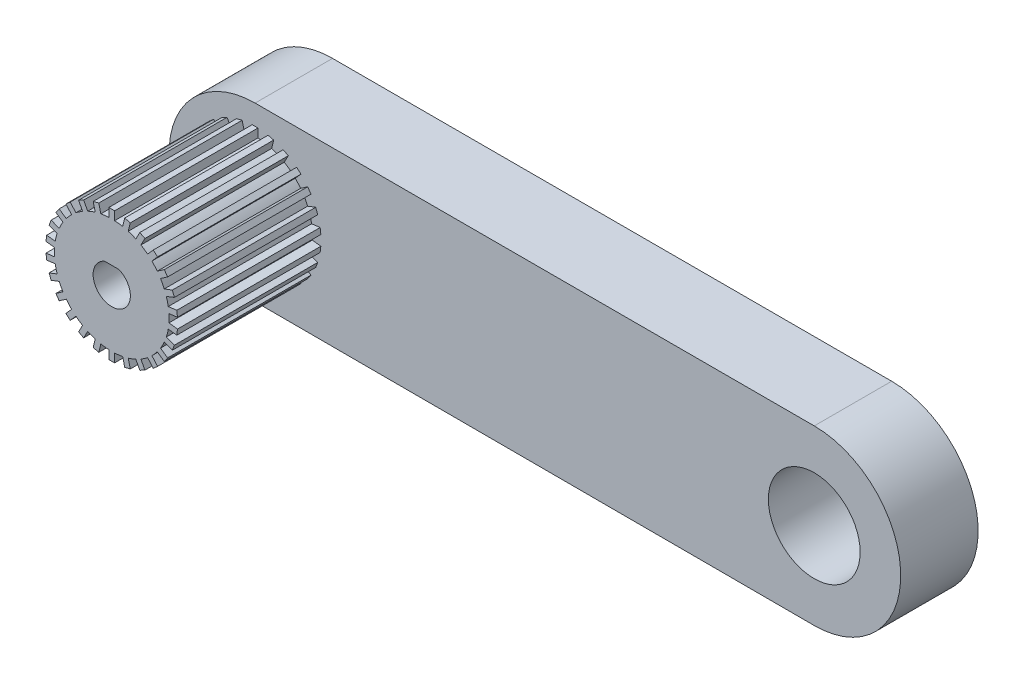
from build123d import *
from build123d.topology import SkipClean

# Parameters (mm, degrees)
BOSS_EXTRUDE1_DEPTH     = 15
SKETCH2_R               = 10
SKETCH2_R_2             = 2.575
BOSS_EXTRUDE2_DEPTH     = 20
SKETCH4_W               = 241.678854034
SKETCH4_H               = 67.941669626
CUT_EXTRUDE2_DEPTH      = 1.5
SKETCH5_R               = 10
SKETCH5_R_2             = 2.575
BOSS_EXTRUDE3_DEPTH     = 10
SKETCH6_R               = 8
CUT_EXTRUDE3_DEPTH      = 122.635473657
BOSS_EXTRUDE4_DEPTH     = 13.5
CUT_EXTRUDE4_DEPTH      = 122.635473657
CUT_EXTRUDE4_DEPTH_BACK = 122.635473657
CUT_EXTRUDE5_START      = -5
SKETCH11_R              = 10
CUT_EXTRUDE5_DEPTH      = 5
BOSS_EXTRUDE5_START     = -25
BOSS_EXTRUDE5_DEPTH     = 25


with BuildPart() as part:
    # Sketch1 → Boss-Extrude1 (new body)
    with BuildSketch(Plane.XY):
        with BuildLine():
            Line((0, -15), (97.476715067, -15.151699694))
            ThreePointArc((97.476715067, -15.151699694), (112.576031495, -0.087589988), (97.500177084, 15))
            Line((97.500177084, 15), (0, 15))
            ThreePointArc((0, 15), (-15, 0), (0, -15))
        make_face()
        with BuildLine():
            ThreePointArc((32.500177084, 7.424141025), (25.000177084, -0.075858975), (32.500177084, -7.575858975))
            Line((32.500177084, -7.575858975), (97.500177084, -7.575858975))
            ThreePointArc((97.500177084, -7.575858975), (105.000177084, -0.075858975), (97.500177084, 7.424141025))
            Line((97.500177084, 7.424141025), (32.500177084, 7.424141025))
        make_face(mode=Mode.SUBTRACT)
    extrude(amount=BOSS_EXTRUDE1_DEPTH)

    # Sketch2 → Boss-Extrude2 (add)
    with BuildSketch(Plane.XY.offset(15)):
        Circle(SKETCH2_R)
        Circle(SKETCH2_R_2, mode=Mode.SUBTRACT)
    extrude(amount=BOSS_EXTRUDE2_DEPTH)

    # Sketch4 → Cut-Extrude2 (cut)
    with BuildSketch(Plane(origin=(0, 0, 0), x_dir=(-1, 0, 0), z_dir=(0, 0, -1))):
        Rectangle(SKETCH4_W, SKETCH4_H)
    extrude(amount=-CUT_EXTRUDE2_DEPTH, mode=Mode.SUBTRACT)

    # Sketch5 → Boss-Extrude3 (add)
    with BuildSketch(Plane.XY.offset(35)):
        Circle(SKETCH5_R)
        Circle(SKETCH5_R_2, mode=Mode.SUBTRACT)
    extrude(amount=BOSS_EXTRUDE3_DEPTH)

    # Sketch6 → Cut-Extrude3 (cut, through all)
    with BuildSketch(Plane(origin=(0, 0, 1.5), x_dir=(-1, 0, 0), z_dir=(0, 0, -1))):
        with Locations((-97.500177084, -0.075858975)):
            Circle(SKETCH6_R)
    extrude(amount=-CUT_EXTRUDE3_DEPTH, mode=Mode.SUBTRACT)

    # Sketch7 → Boss-Extrude4 (add)
    with SkipClean():  # the faces are left unmerged after this step: merging them gives an invalid solid
        with BuildSketch(Plane(origin=(0, 0, 1.5), x_dir=(-1, 0, 0), z_dir=(0, 0, -1))):
            with BuildLine():
                Line((-32.500177084, 7.424141025), (-94.716294903, 7.424141025))
                ThreePointArc((-94.716294903, 7.424141025), (-90.932412721, 4.491905388), (-89.500177084, -0.075858975))
                ThreePointArc((-89.500177084, -0.075858975), (-90.932412721, -4.643623338), (-94.716294903, -7.575858975))
                Line((-94.716294903, -7.575858975), (-32.500177084, -7.575858975))
                ThreePointArc((-32.500177084, -7.575858975), (-40.000177084, -0.075858975), (-32.500177084, 7.424141025))
            make_face()
            with BuildLine():
                ThreePointArc((-25.000177084, -0.075858975), (-27.196876225, 5.227441884), (-32.500177084, 7.424141025))
                ThreePointArc((-32.500177084, 7.424141025), (-40.000177084, -0.075858975), (-32.500177084, -7.575858975))
                ThreePointArc((-32.500177084, -7.575858975), (-27.196876225, -5.379159834), (-25.000177084, -0.075858975))
            make_face()
        extrude(amount=-BOSS_EXTRUDE4_DEPTH)

    # Sketch9 → Cut-Extrude4 (cut, two sides: drawn at the far end of the back side and taken through both)
    with SkipClean():  # the faces are left unmerged after this step: merging them gives an invalid solid
        with BuildSketch(Plane.XY.offset(45).offset(-CUT_EXTRUDE4_DEPTH_BACK)):
            with BuildLine():
                Line((-1.25, 3), (1.25, 3))
                ThreePointArc((1.25, 3), (0, -3.25), (-1.25, 3))
            make_face()
        extrude(amount=CUT_EXTRUDE4_DEPTH + CUT_EXTRUDE4_DEPTH_BACK, mode=Mode.SUBTRACT)

    # Sketch11 → Cut-Extrude5 (cut)
    with SkipClean():  # the faces are left unmerged after this step: merging them gives an invalid solid
        with BuildSketch(Plane.XY.offset(45).offset(CUT_EXTRUDE5_START)):
            Circle(SKETCH11_R)
        extrude(amount=CUT_EXTRUDE5_DEPTH, mode=Mode.SUBTRACT)

    # Sketch12 → Boss-Extrude5 (add)
    with SkipClean():  # the faces are left unmerged after this step: merging them gives an invalid solid
        with BuildSketch(Plane.XY.offset(40).offset(BOSS_EXTRUDE5_START)):
            with BuildLine():
                ThreePointArc((-6.998659787, 7.142741854), (-6.631226582, 7.485107482), (-6.247068007, 7.808594068))
                Line((-6.247068007, 7.808594068), (-7.241751994, 8.93136019))
                Line((-7.241751994, 8.93136019), (-7.993343774, 8.265507976))
                Line((-7.993343774, 8.265507976), (-6.998659787, 7.142741854))
            make_face()
            with BuildLine():
                ThreePointArc((-8.504661464, 5.260297841), (-8.229838659, 5.680647467), (-7.934258441, 6.086669286))
                Line((-7.934258441, 6.086669286), (-9.168734239, 6.938766406))
                Line((-9.168734239, 6.938766406), (-9.739137263, 6.112394961))
                Line((-9.739137263, 6.112394961), (-8.504661464, 5.260297841))
            make_face()
            with BuildLine():
                ThreePointArc((-9.516403131, 3.072144438), (-9.350162427, 3.54604887), (-9.160338614, 4.011009409))
                Line((-9.160338614, 4.011009409), (-10.562862978, 4.54291674))
                Line((-10.562862978, 4.54291674), (-10.918927495, 3.604051769))
                Line((-10.918927495, 3.604051769), (-9.516403131, 3.072144438))
            make_face()
            with BuildLine():
                ThreePointArc((-9.975086038, 0.705449167), (-9.927088741, 1.205366803), (-9.854053203, 1.702244245))
                Line((-9.854053203, 1.702244245), (-11.343116514, 1.883049266))
                Line((-11.343116514, 1.883049266), (-11.46414935, 0.886254187))
                Line((-11.46414935, 0.886254187), (-9.975086038, 0.705449167))
            make_face()
            with BuildLine():
                Line((-11.343116514, -1.883049266), (-9.854053203, -1.702244245))
                ThreePointArc((-9.854053203, -1.702244245), (-9.927088741, -1.205366803), (-9.975086038, -0.705449167))
                Line((-9.975086038, -0.705449167), (-11.46414935, -0.886254187))
                Line((-11.46414935, -0.886254187), (-11.343116514, -1.883049266))
            make_face()
            with BuildLine():
                Line((-10.562862978, -4.54291674), (-9.160338614, -4.011009409))
                ThreePointArc((-9.160338614, -4.011009409), (-9.350162427, -3.54604887), (-9.516403131, -3.072144438))
                Line((-9.516403131, -3.072144438), (-10.918927495, -3.604051769))
                Line((-10.918927495, -3.604051769), (-10.562862978, -4.54291674))
            make_face()
            with BuildLine():
                Line((-9.168734239, -6.938766406), (-7.934258441, -6.086669286))
                ThreePointArc((-7.934258441, -6.086669286), (-8.229838659, -5.680647467), (-8.504661464, -5.260297841))
                Line((-8.504661464, -5.260297841), (-9.739137263, -6.112394961))
                Line((-9.739137263, -6.112394961), (-9.168734239, -6.938766406))
            make_face()
            with BuildLine():
                Line((-7.241751994, -8.93136019), (-6.247068007, -7.808594068))
                ThreePointArc((-6.247068007, -7.808594068), (-6.631226582, -7.485107482), (-6.998659787, -7.142741854))
                Line((-6.998659787, -7.142741854), (-7.993343774, -8.265507976))
                Line((-7.993343774, -8.265507976), (-7.241751994, -8.93136019))
            make_face()
            with BuildLine():
                Line((-4.893905446, -10.404895784), (-4.196820687, -9.076711746))
                ThreePointArc((-4.196820687, -9.076711746), (-4.64723172, -8.854560257), (-5.085921441, -8.610075673))
                Line((-5.085921441, -8.610075673), (-5.783006199, -9.938259711))
                Line((-5.783006199, -9.938259711), (-4.893905446, -10.404895784))
            make_face()
            with BuildLine():
                Line((-2.261642901, -11.273736656), (-1.902669405, -9.817323929))
                ThreePointArc((-1.902669405, -9.817323929), (-2.393156643, -9.709418174), (-2.877607828, -9.57702319))
                Line((-2.877607828, -9.57702319), (-3.236581325, -11.033435916))
                Line((-3.236581325, -11.033435916), (-2.261642901, -11.273736656))
            make_face()
            with BuildLine():
                ThreePointArc((0.502058108, -9.987388931), (0.251108235, -9.996846736), (0, -10))
                Line((0, -10), (0, -11.487388931))
                Line((0, -11.487388931), (0.502058108, -11.487388931))
                Line((0.502058108, -11.487388931), (0.502058108, -9.987388931))
            make_face()
            with BuildLine():
                Line((0, -11.487388931), (0, -10))
                ThreePointArc((0, -10), (-0.251108235, -9.996846736), (-0.502058108, -9.987388931))
                Line((-0.502058108, -9.987388931), (-0.502058108, -11.487388931))
                Line((-0.502058108, -11.487388931), (0, -11.487388931))
            make_face()
            with BuildLine():
                ThreePointArc((2.877607828, -9.57702319), (2.393156643, -9.709418174), (1.902669405, -9.817323929))
                Line((1.902669405, -9.817323929), (2.261642901, -11.273736656))
                Line((2.261642901, -11.273736656), (3.236581325, -11.033435916))
                Line((3.236581325, -11.033435916), (2.877607828, -9.57702319))
            make_face()
            with BuildLine():
                ThreePointArc((5.085921441, -8.610075673), (4.64723172, -8.854560257), (4.196820687, -9.076711746))
                Line((4.196820687, -9.076711746), (4.893905446, -10.404895784))
                Line((4.893905446, -10.404895784), (5.783006199, -9.938259711))
                Line((5.783006199, -9.938259711), (5.085921441, -8.610075673))
            make_face()
            with BuildLine():
                ThreePointArc((6.998659787, -7.142741854), (6.631226582, -7.485107482), (6.247068007, -7.808594068))
                Line((6.247068007, -7.808594068), (7.241751994, -8.93136019))
                Line((7.241751994, -8.93136019), (7.993343774, -8.265507976))
                Line((7.993343774, -8.265507976), (6.998659787, -7.142741854))
            make_face()
            with BuildLine():
                ThreePointArc((8.504661464, -5.260297841), (8.229838659, -5.680647467), (7.934258441, -6.086669286))
                Line((7.934258441, -6.086669286), (9.168734239, -6.938766406))
                Line((9.168734239, -6.938766406), (9.739137263, -6.112394961))
                Line((9.739137263, -6.112394961), (8.504661464, -5.260297841))
            make_face()
            with BuildLine():
                ThreePointArc((9.516403131, -3.072144438), (9.350162427, -3.54604887), (9.160338614, -4.011009409))
                Line((9.160338614, -4.011009409), (10.562862978, -4.54291674))
                Line((10.562862978, -4.54291674), (10.918927495, -3.604051769))
                Line((10.918927495, -3.604051769), (9.516403131, -3.072144438))
            make_face()
            with BuildLine():
                ThreePointArc((9.975086038, -0.705449167), (9.927088741, -1.205366803), (9.854053203, -1.702244245))
                Line((9.854053203, -1.702244245), (11.343116514, -1.883049266))
                Line((11.343116514, -1.883049266), (11.46414935, -0.886254187))
                Line((11.46414935, -0.886254187), (9.975086038, -0.705449167))
            make_face()
            with BuildLine():
                Line((11.343116514, 1.883049266), (9.854053203, 1.702244245))
                ThreePointArc((9.854053203, 1.702244245), (9.927088741, 1.205366803), (9.975086038, 0.705449167))
                Line((9.975086038, 0.705449167), (11.46414935, 0.886254187))
                Line((11.46414935, 0.886254187), (11.343116514, 1.883049266))
            make_face()
            with BuildLine():
                Line((10.562862978, 4.54291674), (9.160338614, 4.011009409))
                ThreePointArc((9.160338614, 4.011009409), (9.350162427, 3.54604887), (9.516403131, 3.072144438))
                Line((9.516403131, 3.072144438), (10.918927495, 3.604051769))
                Line((10.918927495, 3.604051769), (10.562862978, 4.54291674))
            make_face()
            with BuildLine():
                Line((9.168734239, 6.938766406), (7.934258441, 6.086669286))
                ThreePointArc((7.934258441, 6.086669286), (8.229838659, 5.680647467), (8.504661464, 5.260297841))
                Line((8.504661464, 5.260297841), (9.739137263, 6.112394961))
                Line((9.739137263, 6.112394961), (9.168734239, 6.938766406))
            make_face()
            with BuildLine():
                Line((7.241751994, 8.93136019), (6.247068007, 7.808594068))
                ThreePointArc((6.247068007, 7.808594068), (6.631226582, 7.485107482), (6.998659787, 7.142741854))
                Line((6.998659787, 7.142741854), (7.993343774, 8.265507976))
                Line((7.993343774, 8.265507976), (7.241751994, 8.93136019))
            make_face()
            with BuildLine():
                Line((4.893905446, 10.404895784), (4.196820687, 9.076711746))
                ThreePointArc((4.196820687, 9.076711746), (4.64723172, 8.854560257), (5.085921441, 8.610075673))
                Line((5.085921441, 8.610075673), (5.783006199, 9.938259711))
                Line((5.783006199, 9.938259711), (4.893905446, 10.404895784))
            make_face()
            with BuildLine():
                Line((2.261642901, 11.273736656), (1.902669405, 9.817323929))
                ThreePointArc((1.902669405, 9.817323929), (2.393156643, 9.709418174), (2.877607828, 9.57702319))
                Line((2.877607828, 9.57702319), (3.236581325, 11.033435916))
                Line((3.236581325, 11.033435916), (2.261642901, 11.273736656))
            make_face()
            with BuildLine():
                Line((0.502058108, 11.487388931), (0, 11.487388931))
                Line((0, 11.487388931), (0, 10))
                ThreePointArc((0, 10), (0.251108235, 9.996846736), (0.502058108, 9.987388931))
                Line((0.502058108, 9.987388931), (0.502058108, 11.487388931))
            make_face()
            with BuildLine():
                Line((0, 10), (0, 11.487388931))
                Line((0, 11.487388931), (-0.502058108, 11.487388931))
                Line((-0.502058108, 11.487388931), (-0.502058108, 9.987388931))
                ThreePointArc((-0.502058108, 9.987388931), (-0.251108235, 9.996846736), (0, 10))
            make_face()
            with BuildLine():
                ThreePointArc((-2.877607828, 9.57702319), (-2.393156643, 9.709418174), (-1.902669405, 9.817323929))
                Line((-1.902669405, 9.817323929), (-2.261642901, 11.273736656))
                Line((-2.261642901, 11.273736656), (-3.236581325, 11.033435916))
                Line((-3.236581325, 11.033435916), (-2.877607828, 9.57702319))
            make_face()
            with BuildLine():
                ThreePointArc((-5.085921441, 8.610075673), (-4.64723172, 8.854560257), (-4.196820687, 9.076711746))
                Line((-4.196820687, 9.076711746), (-4.893905446, 10.404895784))
                Line((-4.893905446, 10.404895784), (-5.783006199, 9.938259711))
                Line((-5.783006199, 9.938259711), (-5.085921441, 8.610075673))
            make_face()
        extrude(amount=BOSS_EXTRUDE5_DEPTH)


solid = part.part
